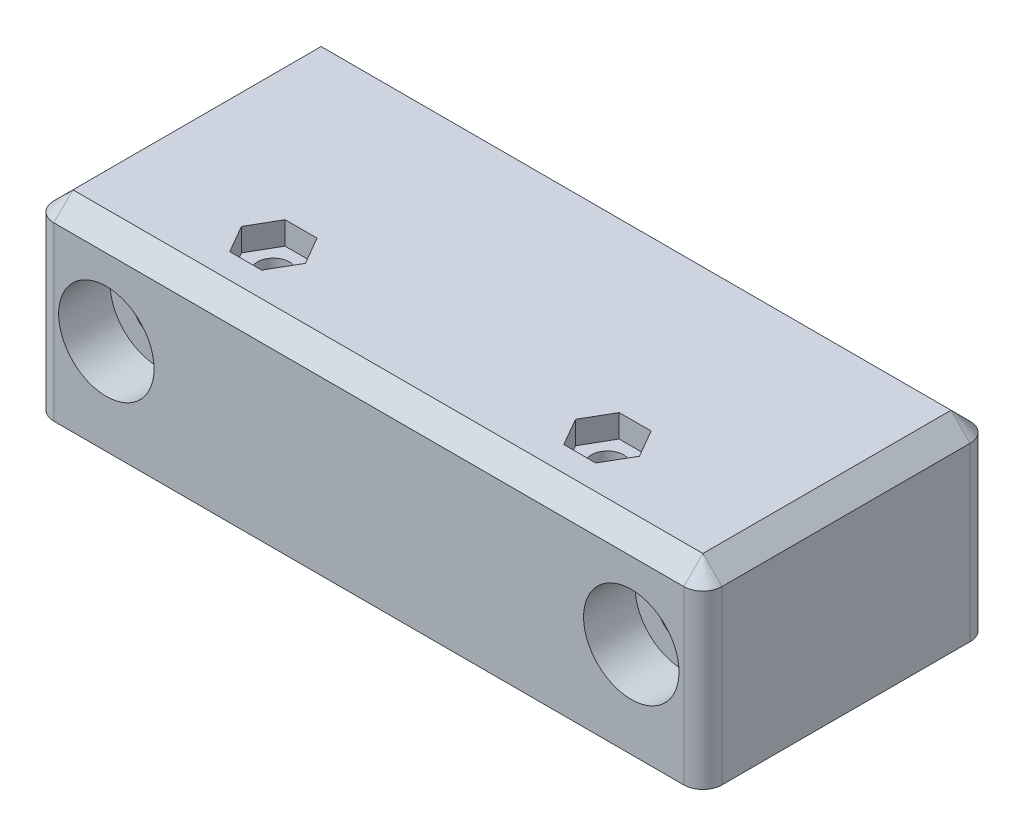
from build123d import *

# Parameters (mm, degrees)
MAIN_BLOCK_SKETCH_W                                 = 70
MAIN_BLOCK_SKETCH_H                                 = 30
MAIN_BLOCK_DEPTH                                    = 20
NUT_TRAPS_DEPTH                                     = 2.4
TENSION_SCREW_HOLES_D                               = 3.4
CBORE_FOR_M5_HEX_SOCKET_HEAD_CAP_SCREW1_D           = 5.5
CBORE_FOR_M5_HEX_SOCKET_HEAD_CAP_SCREW1_CBORE_D     = 10
CBORE_FOR_M5_HEX_SOCKET_HEAD_CAP_SCREW1_CBORE_DEPTH = 5.4
PRINT_HELPER_FILLETS_R                              = 2
COSMETIC_CHAMFER_SIZE                               = 2


with BuildPart() as part:
    # Main Block Sketch → Main Block (new body)
    with BuildSketch(Plane(origin=(0, 0, 0), x_dir=(1, 0, 0), z_dir=(0, 1, 0))):
        with Locations((0, -15)):
            Rectangle(MAIN_BLOCK_SKETCH_W, MAIN_BLOCK_SKETCH_H)
    extrude(amount=MAIN_BLOCK_DEPTH)

    # Nut TrapsSketch → Nut Traps (cut)
    with BuildSketch(Plane(origin=(0, 20, 0), x_dir=(1, 0, 0), z_dir=(0, 1, 0))):
        Polygon((-15.825684219, -19.6), (-19.174315781, -19.6), (-20.848631561, -22.5), (-19.174315781, -25.4), (-15.825684219, -25.4), (-14.151368439, -22.5), align=None)
        Polygon((19.174315781, -19.6), (15.825684219, -19.6), (14.151368439, -22.5), (15.825684219, -25.4), (19.174315781, -25.4), (20.848631561, -22.5), align=None)
    extrude(amount=-NUT_TRAPS_DEPTH, mode=Mode.SUBTRACT)

    # Tension Screw Holes (through all)
    with Locations(Plane(origin=(0, 20, 0), x_dir=(1, 0, 0), z_dir=(0, 1, 0))):
        with Locations((-17.5, -22.5), (17.5, -22.5)):
            Hole(TENSION_SCREW_HOLES_D / 2)

    # CBORE for M5 Hex Socket Head Cap Screw1 (through all)
    with Locations(Plane.XY.offset(30)):
        with Locations((-27.5, 10), (27.5, 10)):
            CounterBoreHole(CBORE_FOR_M5_HEX_SOCKET_HEAD_CAP_SCREW1_D / 2, CBORE_FOR_M5_HEX_SOCKET_HEAD_CAP_SCREW1_CBORE_D / 2, CBORE_FOR_M5_HEX_SOCKET_HEAD_CAP_SCREW1_CBORE_DEPTH)

    # Print Helper Fillets
    print_helper_fillets_edges = [part.edges().sort_by_distance(p)[0] for p in [
        (35, 10, 30),
        (35, 10, 0),
        (-35, 10, 0),
        (-35, 10, 30),
    ]]
    fillet(print_helper_fillets_edges, radius=PRINT_HELPER_FILLETS_R)

    # Cosmetic Chamfer
    cosmetic_chamfer_edges = [part.edges().sort_by_distance(p)[0] for p in [
        (35, 20, 15),
        (0, 20, 30),
        (0, 20, 0),
        (-35, 20, 15),
        (-34.414213562, 20, 29.414213562),
        (-34.414213562, 20, 0.585786438),
        (34.414213562, 20, 0.585786438),
        (34.414213562, 20, 29.414213562),
    ]]
    chamfer(cosmetic_chamfer_edges, length=COSMETIC_CHAMFER_SIZE)


solid = part.part
